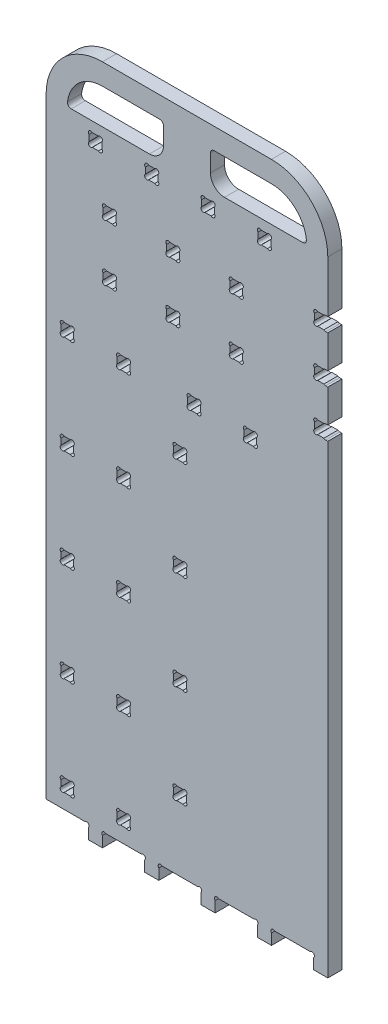
from build123d import *

# Parameters (mm, degrees)
BOSS_EXTRUDE1_DEPTH = 19.05


with BuildPart() as part:
    # Sketch1 → Boss-Extrude1 (new body)
    with BuildSketch(Plane.XY):
        with BuildLine():
            Line((304.8, 869.95), (76.2, 869.95))
            ThreePointArc((76.2, 869.95), (22.318463274, 847.631536726), (0, 793.75))
            Line((0, 793.75), (0, -31.75))
            Line((0, -31.75), (52.659871939, -31.75))
            ThreePointArc((52.659871939, -31.75), (57.15, -31.75), (57.15, -36.240128061))
            Line((57.15, -36.240128061), (57.15, -50.8))
            Line((57.15, -50.8), (76.2, -50.8))
            Line((76.2, -50.8), (76.2, -36.240128061))
            ThreePointArc((76.2, -36.240128061), (76.2, -31.75), (80.690128061, -31.75))
            Line((80.690128061, -31.75), (128.859871939, -31.75))
            ThreePointArc((128.859871939, -31.75), (133.35, -31.75), (133.35, -36.240128061))
            Line((133.35, -36.240128061), (133.35, -50.8))
            Line((133.35, -50.8), (152.4, -50.8))
            Line((152.4, -50.8), (152.4, -36.240128061))
            ThreePointArc((152.4, -36.240128061), (152.4, -31.75), (156.890128061, -31.75))
            Line((156.890128061, -31.75), (205.059871939, -31.75))
            ThreePointArc((205.059871939, -31.75), (209.55, -31.75), (209.55, -36.240128061))
            Line((209.55, -36.240128061), (209.55, -50.8))
            Line((209.55, -50.8), (228.6, -50.8))
            Line((228.6, -50.8), (228.6, -36.240128061))
            ThreePointArc((228.6, -36.240128061), (228.6, -31.75), (233.090128061, -31.75))
            Line((233.090128061, -31.75), (281.259871939, -31.75))
            ThreePointArc((281.259871939, -31.75), (285.75, -31.75), (285.75, -36.240128061))
            Line((285.75, -36.240128061), (285.75, -50.8))
            Line((285.75, -50.8), (304.8, -50.8))
            Line((304.8, -50.8), (304.8, -36.240128061))
            ThreePointArc((304.8, -36.240128061), (304.8, -31.75), (309.290128061, -31.75))
            Line((309.290128061, -31.75), (357.459871939, -31.75))
            ThreePointArc((357.459871939, -31.75), (361.95, -31.75), (361.95, -36.240128061))
            Line((361.95, -36.240128061), (361.95, -50.8))
            Line((361.95, -50.8), (381, -50.8))
            Line((381, -50.8), (381, 577.85))
            Line((381, 577.85), (377.948863142, 577.810147194))
            ThreePointArc((377.948863142, 577.810147194), (376.68933033, 578.035127922), (375.620871939, 578.739))
            Line((375.620871939, 578.739), (367.329128061, 578.739))
            ThreePointArc((367.329128061, 578.739), (362.839, 578.739), (362.839, 583.229128061))
            Line((362.839, 583.229128061), (362.839, 591.520871939))
            ThreePointArc((362.839, 591.520871939), (362.839, 596.011), (367.329128061, 596.011))
            Line((367.329128061, 596.011), (375.620871939, 596.011))
            ThreePointArc((375.620871939, 596.011), (376.68933033, 596.714872078), (377.948863142, 596.939852806))
            Line((377.948863142, 596.939852806), (381, 596.9))
            Line((381, 596.9), (381, 641.35))
            Line((381, 641.35), (377.948863142, 641.310147194))
            ThreePointArc((377.948863142, 641.310147194), (376.68933033, 641.535127922), (375.620871939, 642.239))
            Line((375.620871939, 642.239), (367.329128061, 642.239))
            ThreePointArc((367.329128061, 642.239), (362.839, 642.239), (362.839, 646.729128061))
            Line((362.839, 646.729128061), (362.839, 655.020871939))
            ThreePointArc((362.839, 655.020871939), (362.839, 659.511), (367.329128061, 659.511))
            Line((367.329128061, 659.511), (375.620871939, 659.511))
            ThreePointArc((375.620871939, 659.511), (376.68933033, 660.214872078), (377.948863142, 660.439852806))
            Line((377.948863142, 660.439852806), (381, 660.4))
            Line((381, 660.4), (381, 704.85))
            Line((381, 704.85), (378.374136377, 704.85))
            ThreePointArc((378.374136377, 704.85), (376.890357136, 704.962661882), (375.620871939, 705.739))
            Line((375.620871939, 705.739), (367.329128061, 705.739))
            ThreePointArc((367.329128061, 705.739), (362.839, 705.739), (362.839, 710.229128061))
            Line((362.839, 710.229128061), (362.839, 718.520871939))
            ThreePointArc((362.839, 718.520871939), (362.839, 723.011), (367.329128061, 723.011))
            Line((367.329128061, 723.011), (375.620871939, 723.011))
            ThreePointArc((375.620871939, 723.011), (376.68933033, 723.714872078), (377.948863142, 723.939852806))
            Line((377.948863142, 723.939852806), (381, 723.9))
            Line((381, 723.9), (381, 793.75))
            ThreePointArc((381, 793.75), (358.681536726, 847.631536726), (304.8, 869.95))
        make_face()
        with BuildLine():
            ThreePointArc((24.429128061, -11.811), (19.939, -11.811), (19.939, -7.320871939))
            Line((19.939, -7.320871939), (19.939, 0.970871939))
            ThreePointArc((19.939, 0.970871939), (19.939, 5.461), (24.429128061, 5.461))
            Line((24.429128061, 5.461), (32.720871939, 5.461))
            ThreePointArc((32.720871939, 5.461), (37.211, 5.461), (37.211, 0.970871939))
            Line((37.211, 0.970871939), (37.211, -7.320871939))
            ThreePointArc((37.211, -7.320871939), (37.211, -11.811), (32.720871939, -11.811))
            Line((32.720871939, -11.811), (24.429128061, -11.811))
        make_face(mode=Mode.SUBTRACT)
        with BuildLine():
            ThreePointArc((24.429128061, 121.539), (19.939, 121.539), (19.939, 126.029128061))
            Line((19.939, 126.029128061), (19.939, 134.320871939))
            ThreePointArc((19.939, 134.320871939), (19.939, 138.811), (24.429128061, 138.811))
            Line((24.429128061, 138.811), (32.720871939, 138.811))
            ThreePointArc((32.720871939, 138.811), (37.211, 138.811), (37.211, 134.320871939))
            Line((37.211, 134.320871939), (37.211, 126.029128061))
            ThreePointArc((37.211, 126.029128061), (37.211, 121.539), (32.720871939, 121.539))
            Line((32.720871939, 121.539), (24.429128061, 121.539))
        make_face(mode=Mode.SUBTRACT)
        with BuildLine():
            ThreePointArc((100.629128061, -11.811), (96.139, -11.811), (96.139, -7.320871939))
            Line((96.139, -7.320871939), (96.139, 0.970871939))
            ThreePointArc((96.139, 0.970871939), (96.139, 5.461), (100.629128061, 5.461))
            Line((100.629128061, 5.461), (108.920871939, 5.461))
            ThreePointArc((108.920871939, 5.461), (113.411, 5.461), (113.411, 0.970871939))
            Line((113.411, 0.970871939), (113.411, -7.320871939))
            ThreePointArc((113.411, -7.320871939), (113.411, -11.811), (108.920871939, -11.811))
            Line((108.920871939, -11.811), (100.629128061, -11.811))
        make_face(mode=Mode.SUBTRACT)
        with BuildLine():
            ThreePointArc((176.829128061, 54.864), (172.339, 54.864), (172.339, 59.354128061))
            Line((172.339, 59.354128061), (172.339, 67.645871939))
            ThreePointArc((172.339, 67.645871939), (172.339, 72.136), (176.829128061, 72.136))
            Line((176.829128061, 72.136), (185.120871939, 72.136))
            ThreePointArc((185.120871939, 72.136), (189.611, 72.136), (189.611, 67.645871939))
            Line((189.611, 67.645871939), (189.611, 59.354128061))
            ThreePointArc((189.611, 59.354128061), (189.611, 54.864), (185.120871939, 54.864))
            Line((185.120871939, 54.864), (176.829128061, 54.864))
        make_face(mode=Mode.SUBTRACT)
        with BuildLine():
            ThreePointArc((100.629128061, 121.539), (96.139, 121.539), (96.139, 126.029128061))
            Line((96.139, 126.029128061), (96.139, 134.320871939))
            ThreePointArc((96.139, 134.320871939), (96.139, 138.811), (100.629128061, 138.811))
            Line((100.629128061, 138.811), (108.920871939, 138.811))
            ThreePointArc((108.920871939, 138.811), (113.411, 138.811), (113.411, 134.320871939))
            Line((113.411, 134.320871939), (113.411, 126.029128061))
            ThreePointArc((113.411, 126.029128061), (113.411, 121.539), (108.920871939, 121.539))
            Line((108.920871939, 121.539), (100.629128061, 121.539))
        make_face(mode=Mode.SUBTRACT)
        with BuildLine():
            ThreePointArc((24.429128061, 254.889), (19.939, 254.889), (19.939, 259.379128061))
            Line((19.939, 259.379128061), (19.939, 267.670871939))
            ThreePointArc((19.939, 267.670871939), (19.939, 272.161), (24.429128061, 272.161))
            Line((24.429128061, 272.161), (32.720871939, 272.161))
            ThreePointArc((32.720871939, 272.161), (37.211, 272.161), (37.211, 267.670871939))
            Line((37.211, 267.670871939), (37.211, 259.379128061))
            ThreePointArc((37.211, 259.379128061), (37.211, 254.889), (32.720871939, 254.889))
            Line((32.720871939, 254.889), (24.429128061, 254.889))
        make_face(mode=Mode.SUBTRACT)
        with BuildLine():
            ThreePointArc((24.429128061, 388.239), (19.939, 388.239), (19.939, 392.729128061))
            Line((19.939, 392.729128061), (19.939, 401.020871939))
            ThreePointArc((19.939, 401.020871939), (19.939, 405.511), (24.429128061, 405.511))
            Line((24.429128061, 405.511), (32.720871939, 405.511))
            ThreePointArc((32.720871939, 405.511), (37.211, 405.511), (37.211, 401.020871939))
            Line((37.211, 401.020871939), (37.211, 392.729128061))
            ThreePointArc((37.211, 392.729128061), (37.211, 388.239), (32.720871939, 388.239))
            Line((32.720871939, 388.239), (24.429128061, 388.239))
        make_face(mode=Mode.SUBTRACT)
        with BuildLine():
            ThreePointArc((100.629128061, 254.889), (96.139, 254.889), (96.139, 259.379128061))
            Line((96.139, 259.379128061), (96.139, 267.670871939))
            ThreePointArc((96.139, 267.670871939), (96.139, 272.161), (100.629128061, 272.161))
            Line((100.629128061, 272.161), (108.920871939, 272.161))
            ThreePointArc((108.920871939, 272.161), (113.411, 272.161), (113.411, 267.670871939))
            Line((113.411, 267.670871939), (113.411, 259.379128061))
            ThreePointArc((113.411, 259.379128061), (113.411, 254.889), (108.920871939, 254.889))
            Line((108.920871939, 254.889), (100.629128061, 254.889))
        make_face(mode=Mode.SUBTRACT)
        with BuildLine():
            ThreePointArc((176.829128061, 188.214), (172.339, 188.214), (172.339, 192.704128061))
            Line((172.339, 192.704128061), (172.339, 200.995871939))
            ThreePointArc((172.339, 200.995871939), (172.339, 205.486), (176.829128061, 205.486))
            Line((176.829128061, 205.486), (185.120871939, 205.486))
            ThreePointArc((185.120871939, 205.486), (189.611, 205.486), (189.611, 200.995871939))
            Line((189.611, 200.995871939), (189.611, 192.704128061))
            ThreePointArc((189.611, 192.704128061), (189.611, 188.214), (185.120871939, 188.214))
            Line((185.120871939, 188.214), (176.829128061, 188.214))
        make_face(mode=Mode.SUBTRACT)
        with BuildLine():
            ThreePointArc((100.629128061, 388.239), (96.139, 388.239), (96.139, 392.729128061))
            Line((96.139, 392.729128061), (96.139, 401.020871939))
            ThreePointArc((96.139, 401.020871939), (96.139, 405.511), (100.629128061, 405.511))
            Line((100.629128061, 405.511), (108.920871939, 405.511))
            ThreePointArc((108.920871939, 405.511), (113.411, 405.511), (113.411, 401.020871939))
            Line((113.411, 401.020871939), (113.411, 392.729128061))
            ThreePointArc((113.411, 392.729128061), (113.411, 388.239), (108.920871939, 388.239))
            Line((108.920871939, 388.239), (100.629128061, 388.239))
        make_face(mode=Mode.SUBTRACT)
        with BuildLine():
            ThreePointArc((176.829128061, 321.564), (172.339, 321.564), (172.339, 326.054128061))
            Line((172.339, 326.054128061), (172.339, 334.345871939))
            ThreePointArc((172.339, 334.345871939), (172.339, 338.836), (176.829128061, 338.836))
            Line((176.829128061, 338.836), (185.120871939, 338.836))
            ThreePointArc((185.120871939, 338.836), (189.611, 338.836), (189.611, 334.345871939))
            Line((189.611, 334.345871939), (189.611, 326.054128061))
            ThreePointArc((189.611, 326.054128061), (189.611, 321.564), (185.120871939, 321.564))
            Line((185.120871939, 321.564), (176.829128061, 321.564))
        make_face(mode=Mode.SUBTRACT)
        with BuildLine():
            ThreePointArc((24.429128061, 521.589), (19.939, 521.589), (19.939, 526.079128061))
            Line((19.939, 526.079128061), (19.939, 534.370871939))
            ThreePointArc((19.939, 534.370871939), (19.939, 538.861), (24.429128061, 538.861))
            Line((24.429128061, 538.861), (32.720871939, 538.861))
            ThreePointArc((32.720871939, 538.861), (37.211, 538.861), (37.211, 534.370871939))
            Line((37.211, 534.370871939), (37.211, 526.079128061))
            ThreePointArc((37.211, 526.079128061), (37.211, 521.589), (32.720871939, 521.589))
            Line((32.720871939, 521.589), (24.429128061, 521.589))
        make_face(mode=Mode.SUBTRACT)
        with BuildLine():
            ThreePointArc((81.579128061, 610.489), (77.089, 610.489), (77.089, 614.979128061))
            Line((77.089, 614.979128061), (77.089, 623.270871939))
            ThreePointArc((77.089, 623.270871939), (77.089, 627.761), (81.579128061, 627.761))
            Line((81.579128061, 627.761), (89.870871939, 627.761))
            ThreePointArc((89.870871939, 627.761), (94.361, 627.761), (94.361, 623.270871939))
            Line((94.361, 623.270871939), (94.361, 614.979128061))
            ThreePointArc((94.361, 614.979128061), (94.361, 610.489), (89.870871939, 610.489))
            Line((89.870871939, 610.489), (81.579128061, 610.489))
        make_face(mode=Mode.SUBTRACT)
        with BuildLine():
            ThreePointArc((176.829128061, 454.914), (172.339, 454.914), (172.339, 459.404128061))
            Line((172.339, 459.404128061), (172.339, 467.695871939))
            ThreePointArc((172.339, 467.695871939), (172.339, 472.186), (176.829128061, 472.186))
            Line((176.829128061, 472.186), (185.120871939, 472.186))
            ThreePointArc((185.120871939, 472.186), (189.611, 472.186), (189.611, 467.695871939))
            Line((189.611, 467.695871939), (189.611, 459.404128061))
            ThreePointArc((189.611, 459.404128061), (189.611, 454.914), (185.120871939, 454.914))
            Line((185.120871939, 454.914), (176.829128061, 454.914))
        make_face(mode=Mode.SUBTRACT)
        with BuildLine():
            ThreePointArc((100.629128061, 521.589), (96.139, 521.589), (96.139, 526.079128061))
            Line((96.139, 526.079128061), (96.139, 534.370871939))
            ThreePointArc((96.139, 534.370871939), (96.139, 538.861), (100.629128061, 538.861))
            Line((100.629128061, 538.861), (108.920871939, 538.861))
            ThreePointArc((108.920871939, 538.861), (113.411, 538.861), (113.411, 534.370871939))
            Line((113.411, 534.370871939), (113.411, 526.079128061))
            ThreePointArc((113.411, 526.079128061), (113.411, 521.589), (108.920871939, 521.589))
            Line((108.920871939, 521.589), (100.629128061, 521.589))
        make_face(mode=Mode.SUBTRACT)
        with BuildLine():
            ThreePointArc((167.304128061, 610.489), (162.814, 610.489), (162.814, 614.979128061))
            Line((162.814, 614.979128061), (162.814, 623.270871939))
            ThreePointArc((162.814, 623.270871939), (162.814, 627.761), (167.304128061, 627.761))
            Line((167.304128061, 627.761), (175.595871939, 627.761))
            ThreePointArc((175.595871939, 627.761), (180.086, 627.761), (180.086, 623.270871939))
            Line((180.086, 623.270871939), (180.086, 614.979128061))
            ThreePointArc((180.086, 614.979128061), (180.086, 610.489), (175.595871939, 610.489))
            Line((175.595871939, 610.489), (167.304128061, 610.489))
        make_face(mode=Mode.SUBTRACT)
        with BuildLine():
            ThreePointArc((81.579128061, 686.689), (77.089, 686.689), (77.089, 691.179128061))
            Line((77.089, 691.179128061), (77.089, 699.470871939))
            ThreePointArc((77.089, 699.470871939), (77.089, 703.961), (81.579128061, 703.961))
            Line((81.579128061, 703.961), (89.870871939, 703.961))
            ThreePointArc((89.870871939, 703.961), (94.361, 703.961), (94.361, 699.470871939))
            Line((94.361, 699.470871939), (94.361, 691.179128061))
            ThreePointArc((94.361, 691.179128061), (94.361, 686.689), (89.870871939, 686.689))
            Line((89.870871939, 686.689), (81.579128061, 686.689))
        make_face(mode=Mode.SUBTRACT)
        with BuildLine():
            ThreePointArc((62.529128061, 762.889), (58.039, 762.889), (58.039, 767.379128061))
            Line((58.039, 767.379128061), (58.039, 775.670871939))
            ThreePointArc((58.039, 775.670871939), (58.039, 780.161), (62.529128061, 780.161))
            Line((62.529128061, 780.161), (70.820871939, 780.161))
            ThreePointArc((70.820871939, 780.161), (75.311, 780.161), (75.311, 775.670871939))
            Line((75.311, 775.670871939), (75.311, 767.379128061))
            ThreePointArc((75.311, 767.379128061), (75.311, 762.889), (70.820871939, 762.889))
            Line((70.820871939, 762.889), (62.529128061, 762.889))
        make_face(mode=Mode.SUBTRACT)
        with BuildLine():
            Line((158.75, 836.295), (158.75, 812.8))
            ThreePointArc((158.75, 812.8), (153.170384182, 799.329615818), (139.7, 793.75))
            Line((139.7, 793.75), (33.959372341, 793.75))
            ThreePointArc((33.959372341, 793.75), (30.158861771, 795.459166364), (28.915715307, 799.436567164))
            ThreePointArc((28.915715307, 799.436567164), (44.598434661, 829.379786599), (76.2, 841.375))
            Line((76.2, 841.375), (153.67, 841.375))
            ThreePointArc((153.67, 841.375), (157.262102448, 839.887102448), (158.75, 836.295))
        make_face(mode=Mode.SUBTRACT)
        with BuildLine():
            ThreePointArc((167.304128061, 686.689), (162.814, 686.689), (162.814, 691.179128061))
            Line((162.814, 691.179128061), (162.814, 699.470871939))
            ThreePointArc((162.814, 699.470871939), (162.814, 703.961), (167.304128061, 703.961))
            Line((167.304128061, 703.961), (175.595871939, 703.961))
            ThreePointArc((175.595871939, 703.961), (180.086, 703.961), (180.086, 699.470871939))
            Line((180.086, 699.470871939), (180.086, 691.179128061))
            ThreePointArc((180.086, 691.179128061), (180.086, 686.689), (175.595871939, 686.689))
            Line((175.595871939, 686.689), (167.304128061, 686.689))
        make_face(mode=Mode.SUBTRACT)
        with BuildLine():
            ThreePointArc((138.729128061, 762.889), (134.239, 762.889), (134.239, 767.379128061))
            Line((134.239, 767.379128061), (134.239, 775.670871939))
            ThreePointArc((134.239, 775.670871939), (134.239, 780.161), (138.729128061, 780.161))
            Line((138.729128061, 780.161), (147.020871939, 780.161))
            ThreePointArc((147.020871939, 780.161), (151.511, 780.161), (151.511, 775.670871939))
            Line((151.511, 775.670871939), (151.511, 767.379128061))
            ThreePointArc((151.511, 767.379128061), (151.511, 762.889), (147.020871939, 762.889))
            Line((147.020871939, 762.889), (138.729128061, 762.889))
        make_face(mode=Mode.SUBTRACT)
        with BuildLine():
            ThreePointArc((195.879128061, 521.589), (191.389, 521.589), (191.389, 526.079128061))
            Line((191.389, 526.079128061), (191.389, 534.370871939))
            ThreePointArc((191.389, 534.370871939), (191.389, 538.861), (195.879128061, 538.861))
            Line((195.879128061, 538.861), (204.170871939, 538.861))
            ThreePointArc((204.170871939, 538.861), (208.661, 538.861), (208.661, 534.370871939))
            Line((208.661, 534.370871939), (208.661, 526.079128061))
            ThreePointArc((208.661, 526.079128061), (208.661, 521.589), (204.170871939, 521.589))
            Line((204.170871939, 521.589), (195.879128061, 521.589))
        make_face(mode=Mode.SUBTRACT)
        with BuildLine():
            ThreePointArc((272.079128061, 521.589), (267.589, 521.589), (267.589, 526.079128061))
            Line((267.589, 526.079128061), (267.589, 534.370871939))
            ThreePointArc((267.589, 534.370871939), (267.589, 538.861), (272.079128061, 538.861))
            Line((272.079128061, 538.861), (280.370871939, 538.861))
            ThreePointArc((280.370871939, 538.861), (284.861, 538.861), (284.861, 534.370871939))
            Line((284.861, 534.370871939), (284.861, 526.079128061))
            ThreePointArc((284.861, 526.079128061), (284.861, 521.589), (280.370871939, 521.589))
            Line((280.370871939, 521.589), (272.079128061, 521.589))
        make_face(mode=Mode.SUBTRACT)
        with BuildLine():
            ThreePointArc((253.029128061, 610.489), (248.539, 610.489), (248.539, 614.979128061))
            Line((248.539, 614.979128061), (248.539, 623.270871939))
            ThreePointArc((248.539, 623.270871939), (248.539, 627.761), (253.029128061, 627.761))
            Line((253.029128061, 627.761), (261.320871939, 627.761))
            ThreePointArc((261.320871939, 627.761), (265.811, 627.761), (265.811, 623.270871939))
            Line((265.811, 623.270871939), (265.811, 614.979128061))
            ThreePointArc((265.811, 614.979128061), (265.811, 610.489), (261.320871939, 610.489))
            Line((261.320871939, 610.489), (253.029128061, 610.489))
        make_face(mode=Mode.SUBTRACT)
        with BuildLine():
            ThreePointArc((253.029128061, 686.689), (248.539, 686.689), (248.539, 691.179128061))
            Line((248.539, 691.179128061), (248.539, 699.470871939))
            ThreePointArc((248.539, 699.470871939), (248.539, 703.961), (253.029128061, 703.961))
            Line((253.029128061, 703.961), (261.320871939, 703.961))
            ThreePointArc((261.320871939, 703.961), (265.811, 703.961), (265.811, 699.470871939))
            Line((265.811, 699.470871939), (265.811, 691.179128061))
            ThreePointArc((265.811, 691.179128061), (265.811, 686.689), (261.320871939, 686.689))
            Line((261.320871939, 686.689), (253.029128061, 686.689))
        make_face(mode=Mode.SUBTRACT)
        with BuildLine():
            ThreePointArc((214.929128061, 762.889), (210.439, 762.889), (210.439, 767.379128061))
            Line((210.439, 767.379128061), (210.439, 775.670871939))
            ThreePointArc((210.439, 775.670871939), (210.439, 780.161), (214.929128061, 780.161))
            Line((214.929128061, 780.161), (223.220871939, 780.161))
            ThreePointArc((223.220871939, 780.161), (227.711, 780.161), (227.711, 775.670871939))
            Line((227.711, 775.670871939), (227.711, 767.379128061))
            ThreePointArc((227.711, 767.379128061), (227.711, 762.889), (223.220871939, 762.889))
            Line((223.220871939, 762.889), (214.929128061, 762.889))
        make_face(mode=Mode.SUBTRACT)
        with BuildLine():
            ThreePointArc((291.129128061, 762.889), (286.639, 762.889), (286.639, 767.379128061))
            Line((286.639, 767.379128061), (286.639, 775.670871939))
            ThreePointArc((286.639, 775.670871939), (286.639, 780.161), (291.129128061, 780.161))
            Line((291.129128061, 780.161), (299.420871939, 780.161))
            ThreePointArc((299.420871939, 780.161), (303.911, 780.161), (303.911, 775.670871939))
            Line((303.911, 775.670871939), (303.911, 767.379128061))
            ThreePointArc((303.911, 767.379128061), (303.911, 762.889), (299.420871939, 762.889))
            Line((299.420871939, 762.889), (291.129128061, 762.889))
        make_face(mode=Mode.SUBTRACT)
        with BuildLine():
            ThreePointArc((222.25, 836.295), (223.737897552, 839.887102448), (227.33, 841.375))
            Line((227.33, 841.375), (304.8, 841.375))
            ThreePointArc((304.8, 841.375), (336.401565339, 829.379786599), (352.084284693, 799.436567164))
            ThreePointArc((352.084284693, 799.436567164), (350.841138229, 795.459166364), (347.040627659, 793.75))
            Line((347.040627659, 793.75), (241.3, 793.75))
            ThreePointArc((241.3, 793.75), (227.829615818, 799.329615818), (222.25, 812.8))
            Line((222.25, 812.8), (222.25, 836.295))
        make_face(mode=Mode.SUBTRACT)
    extrude(amount=BOSS_EXTRUDE1_DEPTH)


solid = part.part
